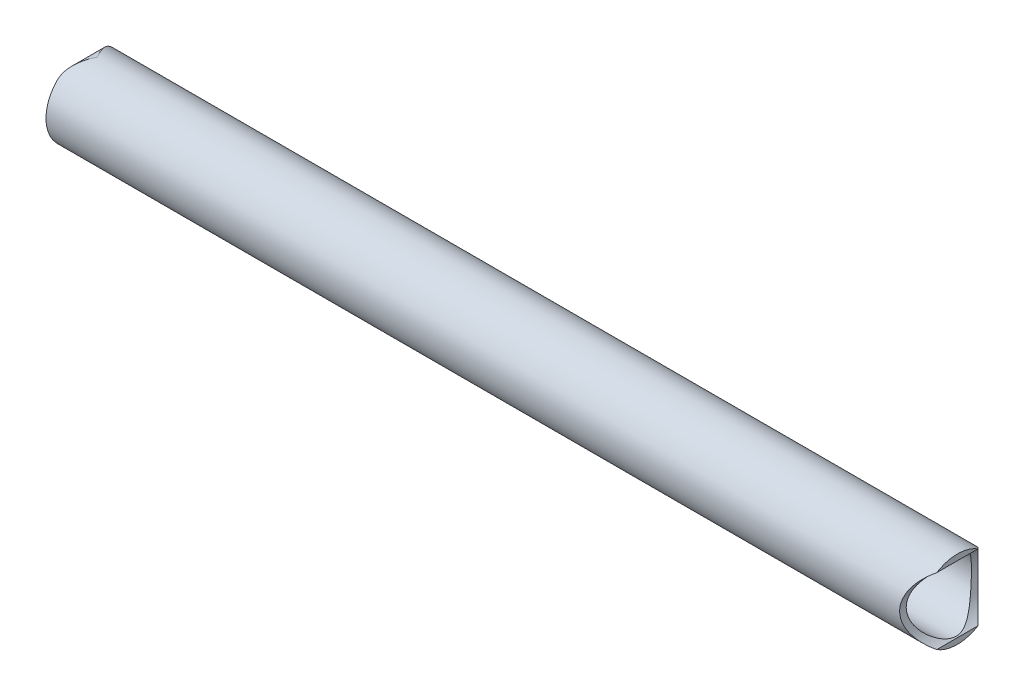
from build123d import *

# Parameters (mm, degrees)
SKETCH1_R               = 21.082
SKETCH1_R_2             = 17.526
BOSS_EXTRUDE1_DEPTH     = 469.10625
CUT_EXTRUDE1_DEPTH      = 471.052736655
CUT_EXTRUDE1_DEPTH_BACK = 471.052736655
CUT_EXTRUDE2_DEPTH      = 471.052736764
CUT_EXTRUDE2_DEPTH_BACK = 471.052736764
SKETCH3_R               = 21.082


with BuildPart() as part:
    # Sketch1 → Boss-Extrude1 (new body)
    with BuildSketch(Plane(origin=(0, 0, 0), x_dir=(0, 0, -1), z_dir=(1, 0, 0))):
        Circle(SKETCH1_R)
        Circle(SKETCH1_R_2, mode=Mode.SUBTRACT)
    extrude(amount=BOSS_EXTRUDE1_DEPTH)

    # Sketch2 → Cut-Extrude1 (cut, two sides: drawn at the far end of the back side and taken through both)
    with BuildSketch(Plane.XY.offset(-CUT_EXTRUDE1_DEPTH_BACK)):
        with BuildLine():
            Line((0, 21.082), (0, 14.732))
            ThreePointArc((0, 14.732), (1.859871939, 19.222128061), (6.35, 21.082))
            Line((6.35, 21.082), (0, 21.082))
        make_face()
    extrude(amount=CUT_EXTRUDE1_DEPTH + CUT_EXTRUDE1_DEPTH_BACK, mode=Mode.SUBTRACT)

    # Sketch3 → Cut-Extrude2 (cut, two sides: drawn at the far end of the back side and taken through both)
    with BuildSketch(Plane.XY.offset(-CUT_EXTRUDE2_DEPTH_BACK)):
        with Locations((480.21875, 0)):
            Circle(SKETCH3_R)
    extrude(amount=CUT_EXTRUDE2_DEPTH + CUT_EXTRUDE2_DEPTH_BACK, mode=Mode.SUBTRACT)


solid = part.part
